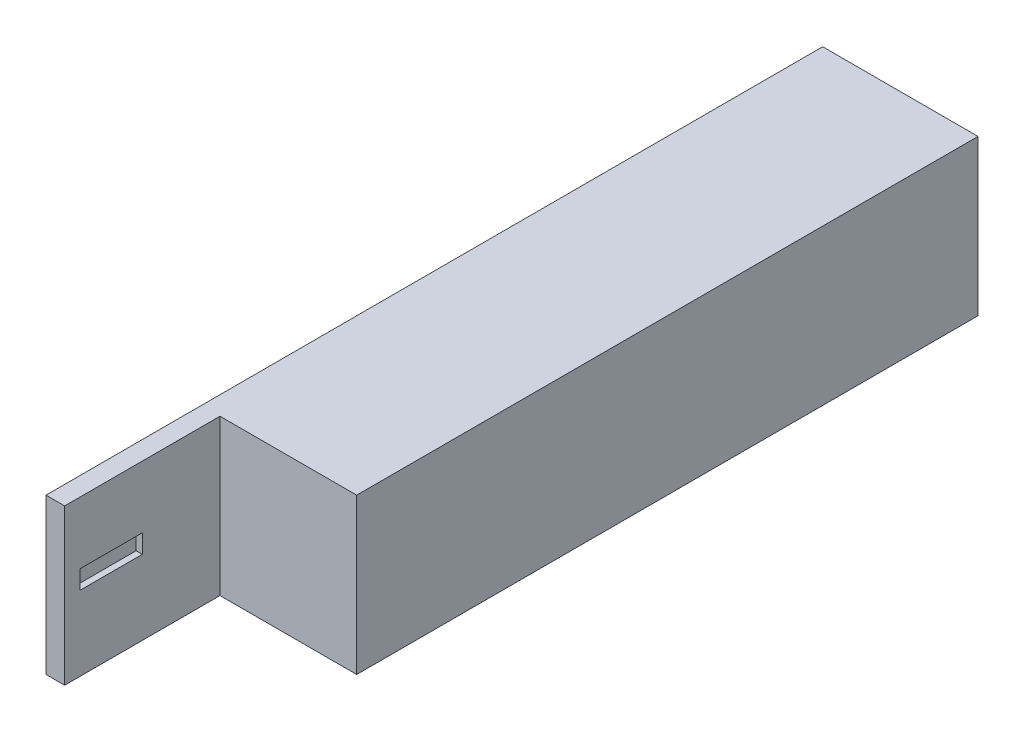
from build123d import *

# Parameters (mm, degrees)
SKETCH1_W           = 50
SKETCH1_H           = 50
BOSS_EXTRUDE1_DEPTH = 200
SKETCH2_W           = 6
SKETCH2_H           = 50
BOSS_EXTRUDE2_DEPTH = 50
SKETCH4_W           = 20
SKETCH4_H           = 6
CUT_EXTRUDE1_DEPTH  = 2
SKETCH5_W           = 11.315
SKETCH5_H           = 6.095
CUT_EXTRUDE2_DEPTH  = 10.84


with BuildPart() as part:
    # Sketch1 → Boss-Extrude1 (new body)
    with BuildSketch(Plane.XY):
        with Locations((25, -25)):
            Rectangle(SKETCH1_W, SKETCH1_H)
    extrude(amount=BOSS_EXTRUDE1_DEPTH)

    # Sketch2 → Boss-Extrude2 (add)
    with BuildSketch(Plane.XY.offset(200)):
        with Locations((3, -25)):
            Rectangle(SKETCH2_W, SKETCH2_H)
    extrude(amount=BOSS_EXTRUDE2_DEPTH)

    # Sketch4 → Cut-Extrude1 (cut)
    with BuildSketch(Plane(origin=(6, 0, 0), x_dir=(0, 0, -1), z_dir=(1, 0, 0))):
        with Locations((-235, -23)):
            Rectangle(SKETCH4_W, SKETCH4_H)
    extrude(amount=-CUT_EXTRUDE1_DEPTH, mode=Mode.SUBTRACT)

    # Sketch5 → Cut-Extrude2 (cut)
    with BuildSketch(Plane(origin=(0, 0, 0), x_dir=(-1, 0, 0), z_dir=(0, 0, -1))):
        Polygon((-36.315, -18.905), (-36.315, -25), (-25, -25), (-13.685, -25), (-13.685, -18.905), align=None)
        with Locations((-30.6575, -28.0475)):
            Rectangle(SKETCH5_W, SKETCH5_H)
        with Locations((-19.3425, -28.0475)):
            Rectangle(SKETCH5_W, SKETCH5_H)
    extrude(amount=-CUT_EXTRUDE2_DEPTH, mode=Mode.SUBTRACT)


solid = part.part
